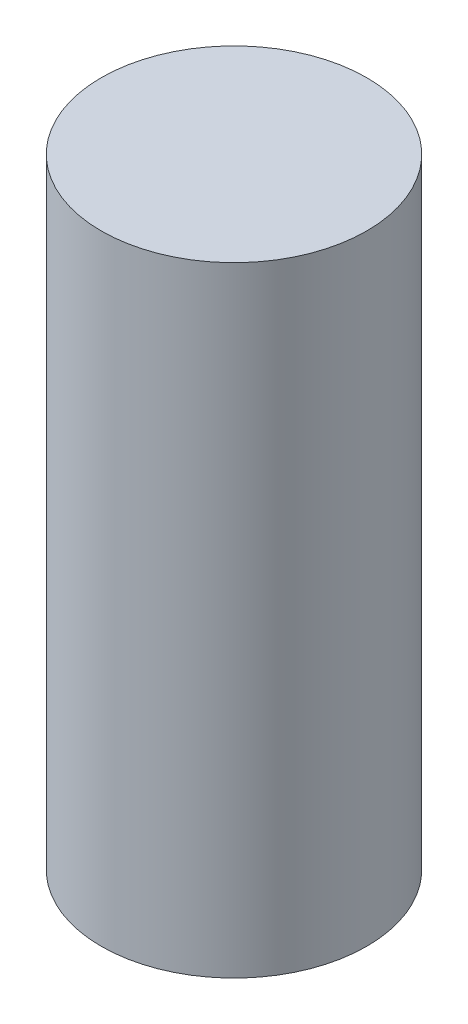
from build123d import *

# Parameters (mm, degrees)
OVEN_AYAR_MIL_4_START = 12
SKETCH1_R             = 6
OVEN_AYAR_MIL_4_DEPTH = 28


with BuildPart() as part:
    # Sketch1 → OVEN_ayar_mil_4 (new body)
    with BuildSketch(Plane(origin=(0, 0, 0), x_dir=(1, 0, 0), z_dir=(0, 1, 0)).offset(OVEN_AYAR_MIL_4_START)):
        with Locations(Location((650, 770, 0), (0, 0, 270))):
            Circle(SKETCH1_R)
    extrude(amount=OVEN_AYAR_MIL_4_DEPTH)


solid = part.part
